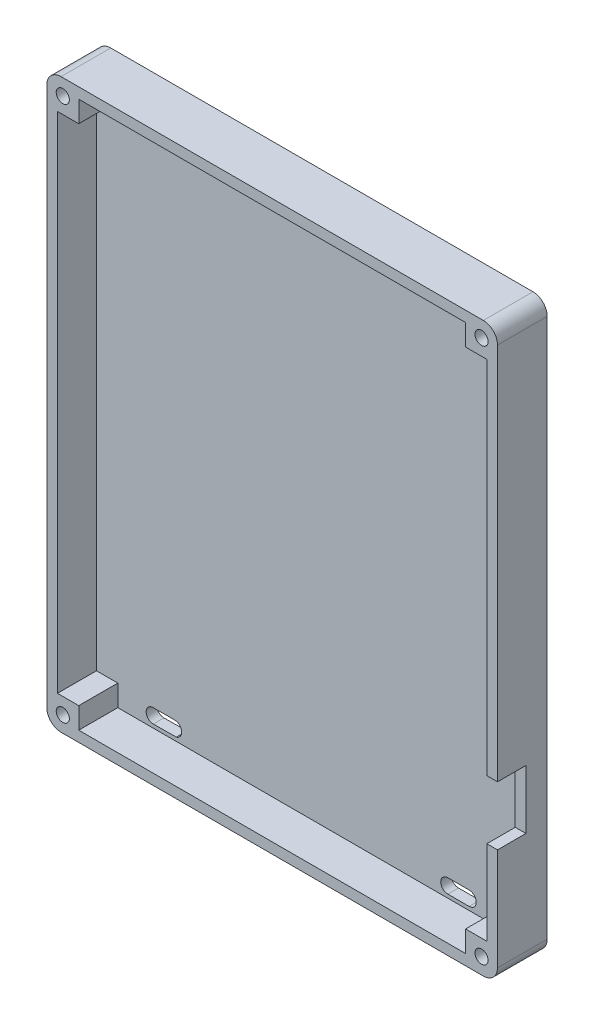
from build123d import *

# Parameters (mm, degrees)
IZIM1_W                     = 63.5
IZIM1_H                     = 80
Y_KSEKLIK_EKSTR_ZYON1_DEPTH = 1.5
IZIM2_W                     = 63.5
IZIM2_H                     = 80
IZIM2_W_2                   = 60.5
IZIM2_H_2                   = 77
Y_KSEKLIK_EKSTR_ZYON2_DEPTH = 5.5
RADYUS1_R                   = 2
KES_EKSTR_ZYON2_DEPTH       = 0.5
IZIM8_W                     = 3
IZIM8_H                     = 3
Y_KSEKLIK_EKSTR_ZYON4_DEPTH = 5.5
IZIM9_R                     = 0.925
KES_EKSTR_ZYON4_DEPTH       = 5
IZIM10_W                    = 4
IZIM10_H                    = 8.3
KES_EKSTR_ZYON5_DEPTH       = 2
KES_EKSTR_ZYON6_DEPTH       = 1.5


with BuildPart() as part:
    # Çizim1 → Yükseklik-Ekstrüzyon1 (new body)
    with BuildSketch(Plane.XY):
        Rectangle(IZIM1_W, IZIM1_H)
    extrude(amount=Y_KSEKLIK_EKSTR_ZYON1_DEPTH)

    # Çizim2 → Yükseklik-Ekstrüzyon2 (add)
    with BuildSketch(Plane.XY.offset(1.5)):
        Rectangle(IZIM2_W, IZIM2_H)
        Rectangle(IZIM2_W_2, IZIM2_H_2, mode=Mode.SUBTRACT)
    extrude(amount=Y_KSEKLIK_EKSTR_ZYON2_DEPTH)

    # Radyus1
    radyus1_edges = [part.edges().sort_by_distance(p)[0] for p in [
        (31.75, -40, 3.5),
        (-31.75, -40, 3.5),
        (-31.75, 40, 3.5),
        (31.75, 40, 3.5),
    ]]
    fillet(radyus1_edges, radius=RADYUS1_R)

    # Çizim6 → Kes-Ekstrüzyon2 (cut)
    with BuildSketch(Plane(origin=(0, 0, 0), x_dir=(-1, 0, 0), z_dir=(0, 0, -1))):
        with BuildLine():
            Line((-3.535533906, 18.535533906), (-5.303300859, 20.303300859))
            ThreePointArc((-5.303300859, 20.303300859), (-7.5, 15), (-5.303300859, 9.696699141))
            Line((-5.303300859, 9.696699141), (-3.535533906, 11.464466094))
            ThreePointArc((-3.535533906, 11.464466094), (-5, 15), (-3.535533906, 18.535533906))
        make_face()
        with BuildLine():
            Line((3.535533906, 18.535533906), (5.303300859, 20.303300859))
            ThreePointArc((5.303300859, 20.303300859), (7.5, 15), (5.303300859, 9.696699141))
            Line((5.303300859, 9.696699141), (3.535533906, 11.464466094))
            ThreePointArc((3.535533906, 11.464466094), (5, 15), (3.535533906, 18.535533906))
        make_face()
        with BuildLine():
            Line((-8.838834765, 23.838834765), (-10.606601718, 25.606601718))
            ThreePointArc((-10.606601718, 25.606601718), (-15, 15), (-10.606601718, 4.393398282))
            Line((-10.606601718, 4.393398282), (-8.838834765, 6.161165235))
            ThreePointArc((-8.838834765, 6.161165235), (-12.5, 15), (-8.838834765, 23.838834765))
        make_face()
        with BuildLine():
            Line((-14.142135624, 29.142135624), (-15.909902577, 30.909902577))
            ThreePointArc((-15.909902577, 30.909902577), (-22.5, 15), (-15.909902577, -0.909902577))
            Line((-15.909902577, -0.909902577), (-14.142135624, 0.857864376))
            ThreePointArc((-14.142135624, 0.857864376), (-20, 15), (-14.142135624, 29.142135624))
        make_face()
        with BuildLine():
            Line((8.838834765, 23.838834765), (10.606601718, 25.606601718))
            ThreePointArc((10.606601718, 25.606601718), (15, 15), (10.606601718, 4.393398282))
            Line((10.606601718, 4.393398282), (8.838834765, 6.161165235))
            ThreePointArc((8.838834765, 6.161165235), (12.5, 15), (8.838834765, 23.838834765))
        make_face()
        with BuildLine():
            Line((14.142135624, 29.142135624), (15.909902577, 30.909902577))
            ThreePointArc((15.909902577, 30.909902577), (22.5, 15), (15.909902577, -0.909902577))
            Line((15.909902577, -0.909902577), (14.142135624, 0.857864376))
            ThreePointArc((14.142135624, 0.857864376), (20, 15), (14.142135624, 29.142135624))
        make_face()
    extrude(amount=-KES_EKSTR_ZYON2_DEPTH, mode=Mode.SUBTRACT)

    # Çizim8 → Yükseklik-Ekstrüzyon4 (add)
    with BuildSketch(Plane.XY.offset(1.5)):
        with Locations((-28.75, 37)):
            Rectangle(IZIM8_W, IZIM8_H)
        with Locations((28.75, 37)):
            Rectangle(IZIM8_W, IZIM8_H)
        with Locations((28.75, -37)):
            Rectangle(IZIM8_W, IZIM8_H)
        with Locations((-28.75, -37)):
            Rectangle(IZIM8_W, IZIM8_H)
    extrude(amount=Y_KSEKLIK_EKSTR_ZYON4_DEPTH)

    # Çizim9 → Kes-Ekstrüzyon4 (cut)
    with BuildSketch(Plane.XY.offset(7)):
        with Locations((-29.5, 37.75)):
            Circle(IZIM9_R)
        with Locations(Location((29.5, 37.75, 0), (0, 0, 180))):
            Circle(IZIM9_R)
        with Locations((29.5, -37.75)):
            Circle(IZIM9_R)
        with Locations(Location((-29.5, -37.75, 0), (0, 0, 180))):
            Circle(IZIM9_R)
    extrude(amount=-KES_EKSTR_ZYON4_DEPTH, mode=Mode.SUBTRACT)

    # Çizim10 → Kes-Ekstrüzyon5 (cut)
    with BuildSketch(Plane(origin=(31.75, 0, 0), x_dir=(0, 0, -1), z_dir=(1, 0, 0))):
        with Locations((-5, -19.45)):
            Rectangle(IZIM10_W, IZIM10_H)
    extrude(amount=-KES_EKSTR_ZYON5_DEPTH, mode=Mode.SUBTRACT)

    # Çizim11 → Kes-Ekstrüzyon6 (cut)
    with BuildSketch(Plane.XY.offset(1.5)):
        with BuildLine():
            Line((-22.25, -36), (-19.25, -36))
            ThreePointArc((-19.25, -36), (-18.257492443, -36.877816736), (-19.007464375, -37.9701425))
            Line((-19.007464375, -37.9701425), (-22.25, -38))
            ThreePointArc((-22.25, -38), (-23.25, -37), (-22.25, -36))
        make_face()
        with BuildLine():
            Line((19.25, -36), (22.25, -36))
            ThreePointArc((22.25, -36), (23.25, -37), (22.25, -38))
            Line((22.25, -38), (19.25, -38))
            ThreePointArc((19.25, -38), (18.25, -37), (19.25, -36))
        make_face()
    extrude(amount=-KES_EKSTR_ZYON6_DEPTH, mode=Mode.SUBTRACT)


solid = part.part
